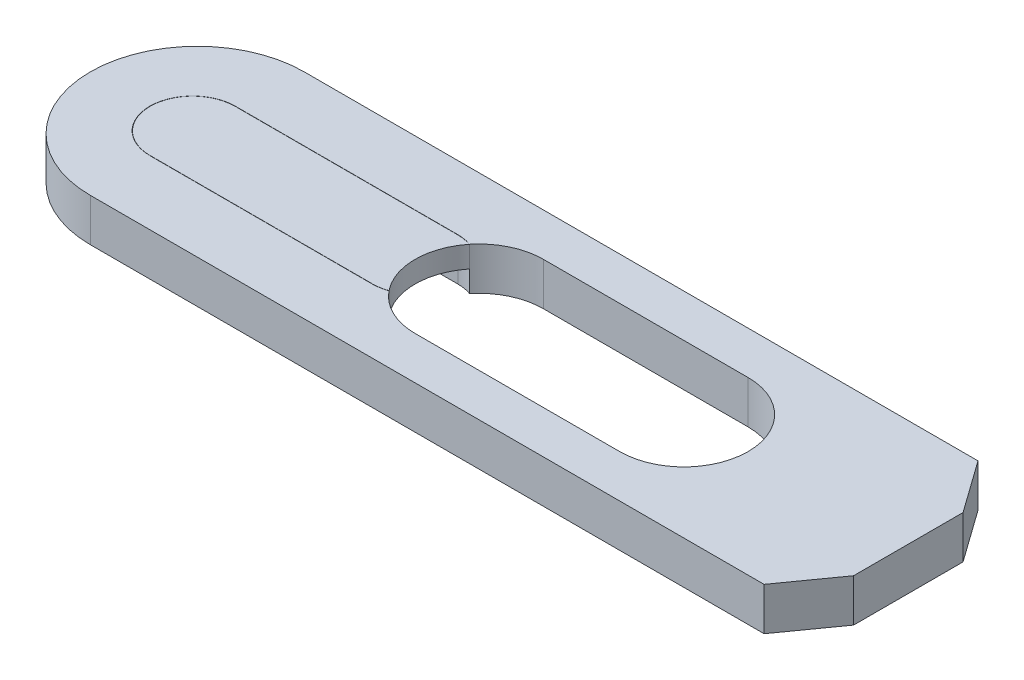
from build123d import *

# Parameters (mm, degrees)
BOSS_EXTRUDE1_DEPTH = 5.08
CUT_EXTRUDE1_DEPTH  = 56.098829616
BOSS_EXTRUDE2_DEPTH = 2.54
CUT_EXTRUDE2_DEPTH  = 56.098829616


with BuildPart() as part:
    # Sketch1 → Boss-Extrude1 (new body)
    with BuildSketch(Plane(origin=(0, 0, 0), x_dir=(1, 0, 0), z_dir=(0, 1, 0))):
        with BuildLine():
            Line((40.005, -10.16), (-40.005, -10.16))
            ThreePointArc((-40.005, -10.16), (-52.705, 2.54), (-40.005, 15.24))
            Line((-40.005, 15.24), (40.005, 15.24))
            ThreePointArc((40.005, 15.24), (52.705, 2.54), (40.005, -10.16))
        make_face()
    extrude(amount=BOSS_EXTRUDE1_DEPTH)

    # Sketch2 → Cut-Extrude1 (cut, through all)
    with BuildSketch(Plane(origin=(0, 5.08, 0), x_dir=(1, 0, 0), z_dir=(0, 1, 0))):
        with BuildLine():
            Line((-6.523950451, 10.16), (17.783749378, 10.16))
            ThreePointArc((17.783749378, 10.16), (25.403749378, 2.54), (17.783749378, -5.08))
            Line((17.783749378, -5.08), (-6.523950451, -5.08))
            ThreePointArc((-6.523950451, -5.08), (-9.807899227, -4.336051224), (-12.450617118, -2.249469931))
            ThreePointArc((-12.450617118, -2.249469931), (-13.284912399, -2.466840683), (-14.143950451, -2.54))
            Line((-14.143950451, -2.54), (-40.556900142, -2.54))
            ThreePointArc((-40.556900142, -2.54), (-45.636900142, 2.54), (-40.556900142, 7.62))
            Line((-40.556900142, 7.62), (-14.143950451, 7.62))
            ThreePointArc((-14.143950451, 7.62), (-13.284912399, 7.546840683), (-12.450617118, 7.329469931))
            ThreePointArc((-12.450617118, 7.329469931), (-9.807899227, 9.416051224), (-6.523950451, 10.16))
        make_face()
    extrude(amount=-CUT_EXTRUDE1_DEPTH, mode=Mode.SUBTRACT)

    # Sketch4 → Cut-Extrude2 (cut, through all)
    with BuildSketch(Plane(origin=(0, 5.08, 0), x_dir=(1, 0, 0), z_dir=(0, 1, 0))):
        Polygon((40.005, 15.24), (44.43129094, 9.037391797), (44.43129094, -3.957391797), (40.005, -10.16), (40.005, -12.227542852), (70.314575482, -12.227542852), (70.314575482, 15.24), align=None)
    extrude(amount=-CUT_EXTRUDE2_DEPTH, mode=Mode.SUBTRACT)


with BuildPart() as body_2:
    # Sketch3 → Boss-Extrude2 (new body)
    with BuildSketch(Plane(origin=(0, 5.08, 0), x_dir=(1, 0, 0), z_dir=(0, 1, 0))):
        with BuildLine():
            Line((-14.143950451, 7.593133552), (-40.556900142, 7.593133552))
            ThreePointArc((-40.556900142, 7.593133552), (-45.610033694, 2.54), (-40.556900142, -2.513133552))
            Line((-40.556900142, -2.513133552), (-14.143950451, -2.513133552))
            ThreePointArc((-14.143950451, -2.513133552), (-13.294110614, -2.441157591), (-12.468480721, -2.227280134))
            ThreePointArc((-12.468480721, -2.227280134), (-14.143950451, 2.54), (-12.468480721, 7.307280134))
            ThreePointArc((-12.468480721, 7.307280134), (-13.294110614, 7.521157591), (-14.143950451, 7.593133552))
        make_face()
    extrude(amount=-BOSS_EXTRUDE2_DEPTH)


solid = Compound([part.part, body_2.part])
